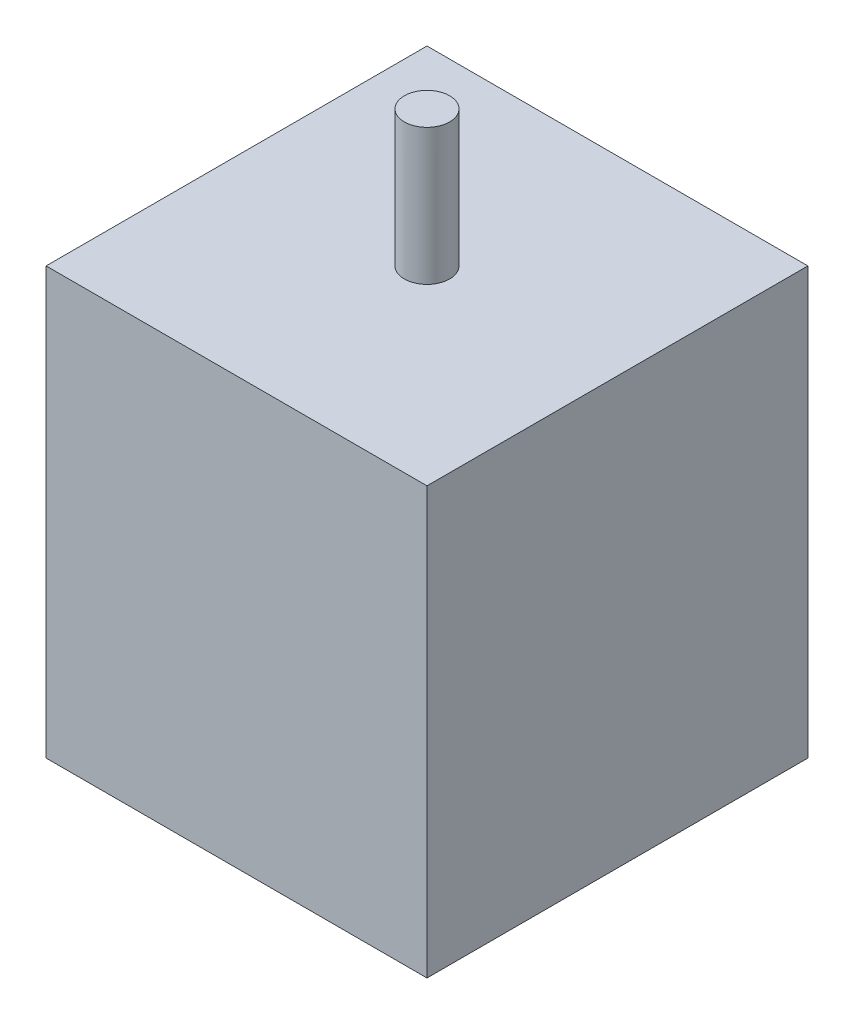
from build123d import *

# Parameters (mm, degrees)
SKETCH1_W      = 42
SKETCH1_H      = 42
EXTRUDE1_DEPTH = 47
SKETCH2_R      = 2.5
EXTRUDE2_DEPTH = 15


with BuildPart() as part:
    # Sketch1 → Extrude1 (new body)
    with BuildSketch(Plane(origin=(0, 0, 0), x_dir=(1, 0, 0), z_dir=(0, 1, 0))):
        with Locations((21, 21)):
            Rectangle(SKETCH1_W, SKETCH1_H)
    extrude(amount=EXTRUDE1_DEPTH)

    # Sketch2 → Extrude2 (add)
    with BuildSketch(Plane(origin=(0, 47, 0), x_dir=(1, 0, 0), z_dir=(0, 1, 0))):
        with Locations(Location((21, 21, 0), (0, 0, 90))):
            Circle(SKETCH2_R)
    extrude(amount=EXTRUDE2_DEPTH)


solid = part.part
